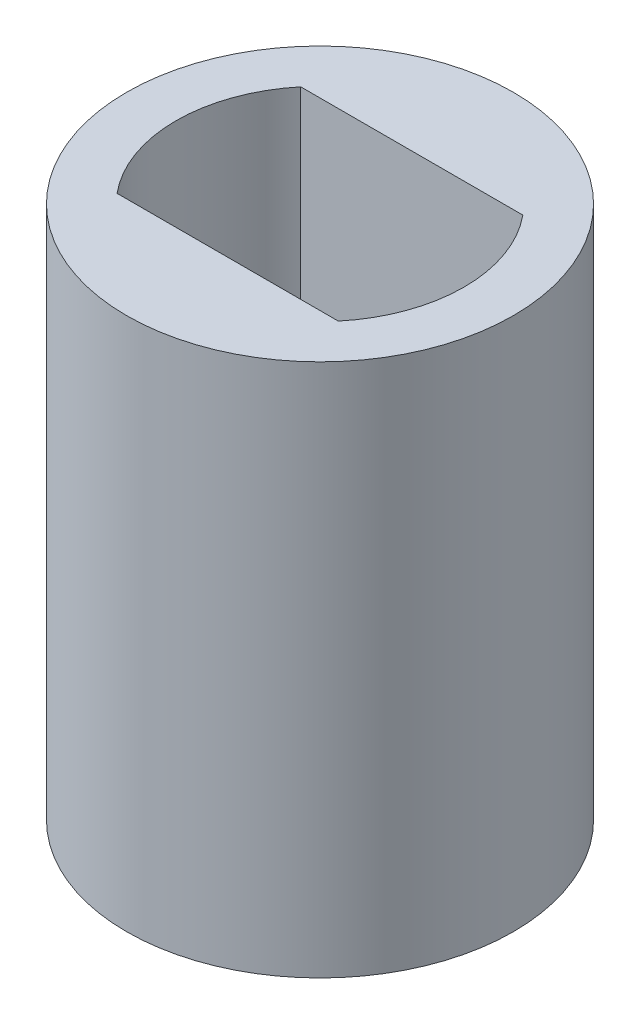
from build123d import *

# Parameters (mm, degrees)
ESBO_O1_R                = 3.625
RESSALTO_EXTRUS_O1_DEPTH = 10


with BuildPart() as part:
    # Esboço1 → Ressalto-extrusão1 (new body)
    with BuildSketch(Plane(origin=(0, 0, 0), x_dir=(1, 0, 0), z_dir=(0, 1, 0))):
        with Locations(Location((0, 0, 0), (0, 0, 270))):
            Circle(ESBO_O1_R)
        with BuildLine():
            Line((-2.081249625, 1.72), (2.081249625, 1.72))
            ThreePointArc((2.081249625, 1.72), (2.699992193, -0.00649294), (2.072953091, -1.729990024))
            Line((2.072953091, -1.729990024), (-2.072953091, -1.729990024))
            ThreePointArc((-2.072953091, -1.729990024), (-2.699992193, -0.00649294), (-2.081249625, 1.72))
        make_face(mode=Mode.SUBTRACT)
    extrude(amount=RESSALTO_EXTRUS_O1_DEPTH)


solid = part.part
